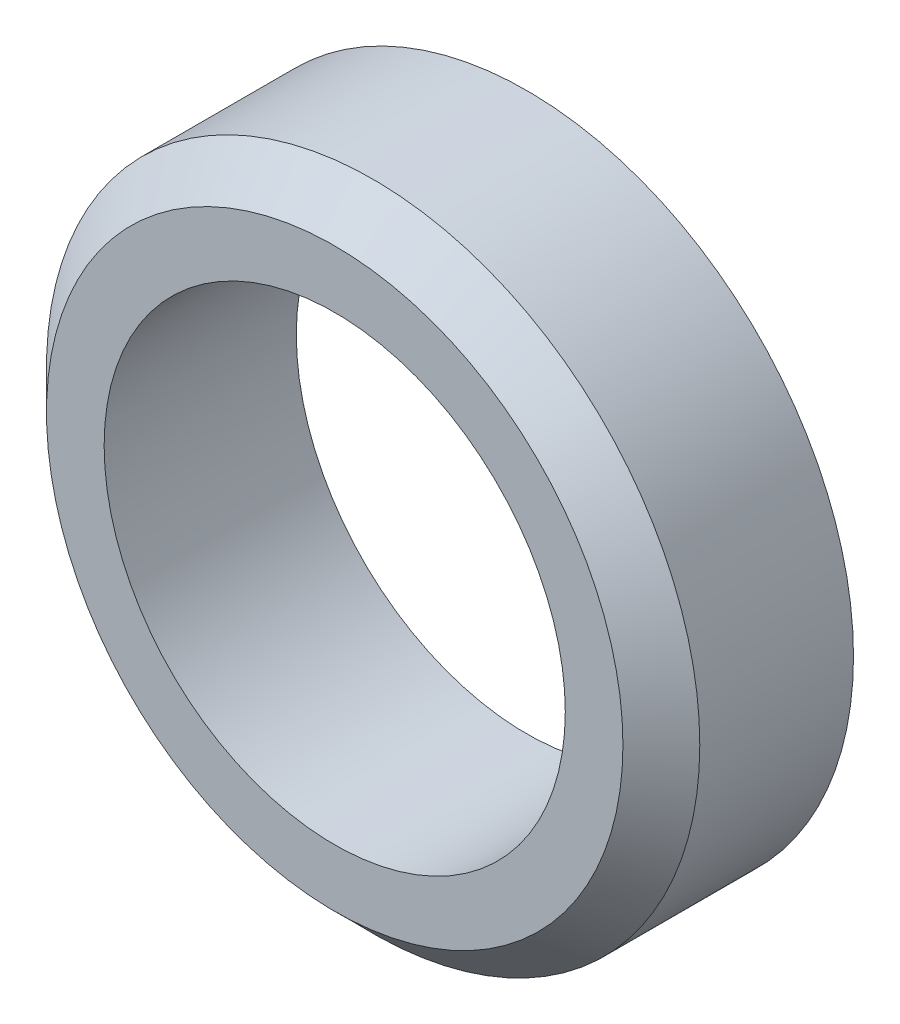
from build123d import *

# Parameters (mm, degrees)
SKETCH_1_R          = 42.5
EXTRUDE_1_DEPTH     = 25
CHAMFER_1_SIZE      = 5
SKETCH_2_R          = 30
CUT_EXTRUDE_1_DEPTH = 66.096082831


with BuildPart() as part:
    # Эскиз1 → Бобышка-Вытянуть1 (new body)
    with BuildSketch(Plane.XY):
        Circle(SKETCH_1_R)
    extrude(amount=EXTRUDE_1_DEPTH)

    # Фаска1
    chamfer_1_edges = [part.edges().sort_by_distance(p)[0] for p in [
        (-42.5, 0, 25),
    ]]
    chamfer(chamfer_1_edges, length=CHAMFER_1_SIZE)

    # Эскиз2 → Вырез-Вытянуть1 (cut, through all)
    with BuildSketch(Plane(origin=(0, 0, 0), x_dir=(-1, 0, 0), z_dir=(0, 0, -1))):
        Circle(SKETCH_2_R)
    extrude(amount=-CUT_EXTRUDE_1_DEPTH, mode=Mode.SUBTRACT)


solid = part.part
